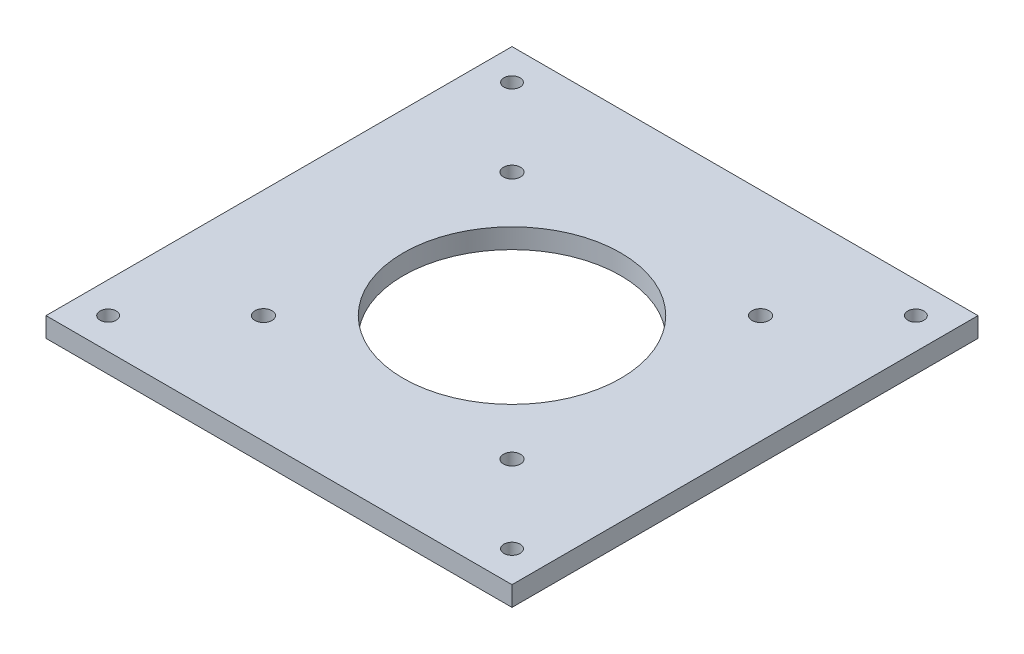
from build123d import *

# Parameters (mm, degrees)
SKETCH2_W           = 150
SKETCH2_H           = 150
SKETCH2_R           = 2.6
SKETCH2_R_2         = 2.75
SKETCH2_R_3         = 35
BOSS_EXTRUDE1_DEPTH = 6.35


with BuildPart() as part:
    # Sketch2 → Boss-Extrude1 (new body)
    with BuildSketch(Plane(origin=(0, 0, 0), x_dir=(1, 0, 0), z_dir=(0, 1, 0))):
        Rectangle(SKETCH2_W, SKETCH2_H)
        with Locations(Location((-65, 65, 0), (0, 0, 270))):
            Circle(SKETCH2_R, mode=Mode.SUBTRACT)
        with Locations(Location((65, 65, 0), (0, 0, 90))):
            Circle(SKETCH2_R, mode=Mode.SUBTRACT)
        with Locations(Location((65, -65, 0), (0, 0, 270))):
            Circle(SKETCH2_R, mode=Mode.SUBTRACT)
        with Locations(Location((-65, -65, 0), (0, 0, 90))):
            Circle(SKETCH2_R, mode=Mode.SUBTRACT)
        with Locations(Location((-40, 40, 0), (0, 0, 270))):
            Circle(SKETCH2_R_2, mode=Mode.SUBTRACT)
        with Locations(Location((40, 40, 0), (0, 0, 90))):
            Circle(SKETCH2_R_2, mode=Mode.SUBTRACT)
        with Locations(Location((40, -40, 0), (0, 0, 270))):
            Circle(SKETCH2_R_2, mode=Mode.SUBTRACT)
        with Locations(Location((-40, -40, 0), (0, 0, 90))):
            Circle(SKETCH2_R_2, mode=Mode.SUBTRACT)
        with Locations(Location((0, 0, 0), (0, 0, 270))):
            Circle(SKETCH2_R_3, mode=Mode.SUBTRACT)
    extrude(amount=BOSS_EXTRUDE1_DEPTH)


solid = part.part
